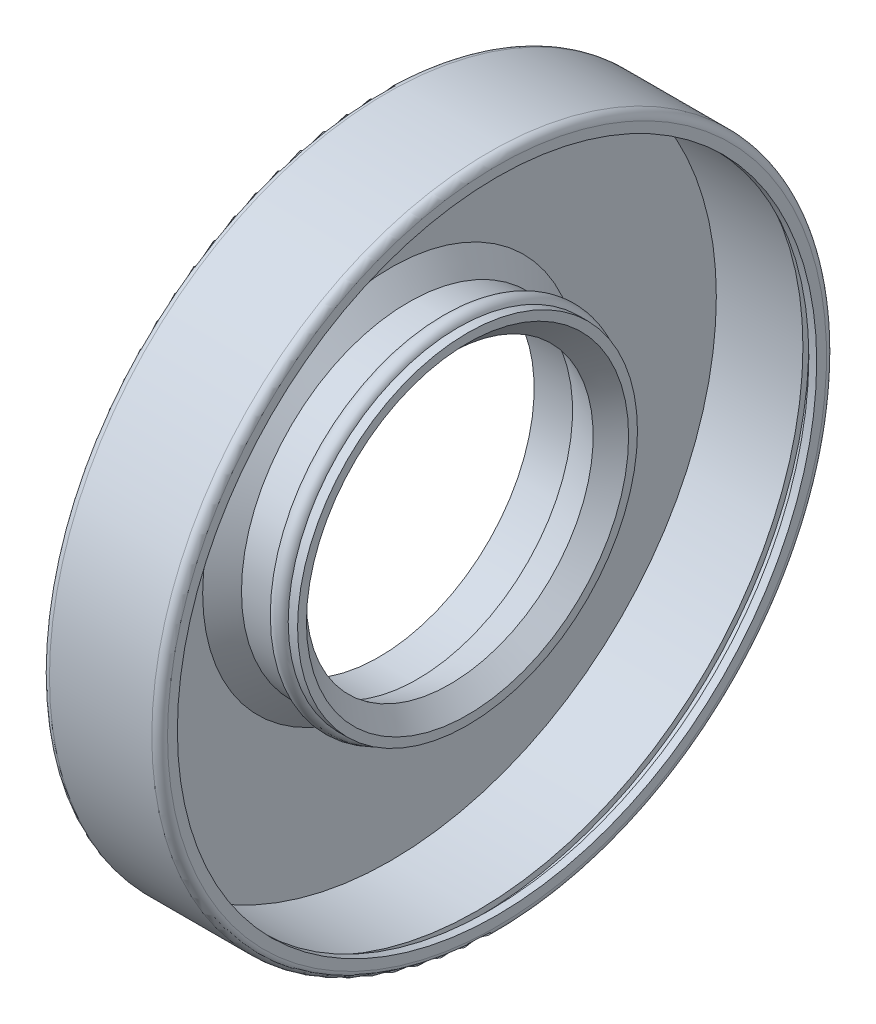
from build123d import *


with BuildPart() as part:
    # Esquisse1 → Base-Révolution (revolve)
    with BuildSketch(Plane(origin=(0, 0, 0), x_dir=(1, 0, 0), z_dir=(0, 1, 0)), mode=Mode.PRIVATE) as base_r_volution_sk:
        with BuildLine():
            Line((0, 9.2), (0, 19.533333333))
            ThreePointArc((0, 19.533333333), (0.136683502, 19.863316498), (0.466666667, 20))
            Line((0.466666667, 20), (6.533333333, 20))
            ThreePointArc((6.533333333, 20), (6.863316498, 19.863316498), (7, 19.533333333))
            Line((7, 19.533333333), (7, 18.95))
            Line((7, 18.95), (6.533333333, 18.95))
            Line((6.533333333, 18.95), (6.533333333, 19.65))
            Line((6.533333333, 19.65), (5.833333333, 19.65))
            Line((5.833333333, 19.65), (5.833333333, 19.3))
            Line((5.833333333, 19.3), (0.7, 19.3))
            Line((0.7, 19.3), (0.7, 11.151341272))
            Line((0.7, 11.151341272), (1.75, 9.9))
            Line((1.75, 9.9), (3.675, 9.9))
            ThreePointArc((3.675, 9.9), (4.111221461, 10.417439244), (4.694974747, 10.075))
            Line((4.694974747, 10.075), (5.25, 10.075))
            Line((5.25, 10.075), (5.25, 9.55))
            Line((5.25, 9.55), (4.2, 8.5))
            Line((4.2, 8.5), (2.276765806, 9.2))
            Line((2.276765806, 9.2), (0, 9.2))
        make_face()
    revolve(base_r_volution_sk.sketch.rotate(Axis((0, 0, 0), (1, 0, 0)), 180), axis=Axis((0, 0, 0), (1, 0, 0)))


solid = part.part
